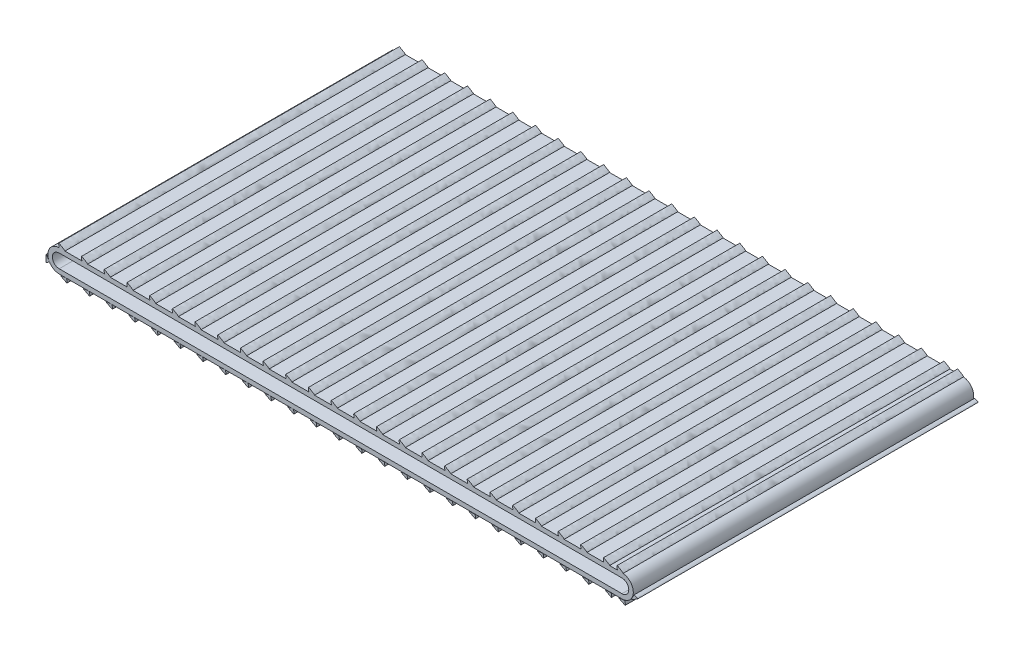
from build123d import *

# Parameters (mm, degrees)
BOSS_EXTRUDE1_DEPTH = 750
BOSS_EXTRUDE2_DEPTH = 750


with BuildPart() as part:
    # Sketch1 → Boss-Extrude1 (new body)
    with BuildSketch(Plane.XY):
        with BuildLine():
            Line((0, 0), (1240, 0))
            ThreePointArc((1240, 0), (1265, 25), (1240, 50))
            Line((1240, 50), (0, 50))
            ThreePointArc((0, 50), (-25, 25), (0, 0))
        make_face()
        with BuildLine():
            Line((0, 40), (1240, 40))
            ThreePointArc((1240, 40), (1255, 25), (1240, 10))
            Line((1240, 10), (0, 10))
            ThreePointArc((0, 10), (-15, 25), (0, 40))
        make_face(mode=Mode.SUBTRACT)
    extrude(amount=BOSS_EXTRUDE1_DEPTH)

    # Sketch3 → Boss-Extrude2 (add)
    with BuildSketch(Plane.XY):
        with BuildLine():
            Line((7.447139139, 50), (0, 50))
            add(Edge.make_bspline(
                [(0, 50), (-0.902771126, 54.485143955), (-2.069751857, 60.282933027), (5.151725689, 55.11021103), (14.289362764, 50.76827718), (12.567785976, 50)],
                knots=[0, 0, 0, 0, 0.295977916, 0.382600324, 0.822654792, 0.822654792, 0.822654792, 0.822654792], degree=3))
            Line((12.567785976, 50), (7.447139139, 50))
        make_face()
        with BuildLine():
            Line((57.447139139, 50), (62.567785976, 50))
            add(Edge.make_bspline(
                [(50, 50), (49.097228874, 54.485143955), (47.930248143, 60.282933027), (55.151725689, 55.11021103), (64.289362764, 50.76827718), (62.567785976, 50)],
                knots=[0, 0, 0, 0, 0.295977916, 0.382600324, 0.822654792, 0.822654792, 0.822654792, 0.822654792], degree=3))
            Line((50, 50), (57.447139139, 50))
        make_face()
        with BuildLine():
            Line((107.447139139, 50), (112.567785976, 50))
            add(Edge.make_bspline(
                [(100, 50), (99.097228874, 54.485143955), (97.930248143, 60.282933027), (105.151725689, 55.11021103), (114.289362764, 50.76827718), (112.567785976, 50)],
                knots=[0, 0, 0, 0, 0.295977916, 0.382600324, 0.822654792, 0.822654792, 0.822654792, 0.822654792], degree=3))
            Line((100, 50), (107.447139139, 50))
        make_face()
        with BuildLine():
            Line((157.447139139, 50), (162.567785976, 50))
            add(Edge.make_bspline(
                [(150, 50), (149.097228874, 54.485143955), (147.930248143, 60.282933027), (155.151725689, 55.11021103), (164.289362764, 50.76827718), (162.567785976, 50)],
                knots=[0, 0, 0, 0, 0.295977916, 0.382600324, 0.822654792, 0.822654792, 0.822654792, 0.822654792], degree=3))
            Line((150, 50), (157.447139139, 50))
        make_face()
        with BuildLine():
            Line((207.447139139, 50), (212.567785976, 50))
            add(Edge.make_bspline(
                [(200, 50), (199.097228874, 54.485143955), (197.930248143, 60.282933027), (205.151725689, 55.11021103), (214.289362764, 50.76827718), (212.567785976, 50)],
                knots=[0, 0, 0, 0, 0.295977916, 0.382600324, 0.822654792, 0.822654792, 0.822654792, 0.822654792], degree=3))
            Line((200, 50), (207.447139139, 50))
        make_face()
        with BuildLine():
            Line((257.447139139, 50), (262.567785976, 50))
            add(Edge.make_bspline(
                [(250, 50), (249.097228874, 54.485143955), (247.930248143, 60.282933027), (255.151725689, 55.11021103), (264.289362764, 50.76827718), (262.567785976, 50)],
                knots=[0, 0, 0, 0, 0.295977916, 0.382600324, 0.822654792, 0.822654792, 0.822654792, 0.822654792], degree=3))
            Line((250, 50), (257.447139139, 50))
        make_face()
        with BuildLine():
            Line((307.447139139, 50), (312.567785976, 50))
            add(Edge.make_bspline(
                [(300, 50), (299.097228874, 54.485143955), (297.930248143, 60.282933027), (305.151725689, 55.11021103), (314.289362764, 50.76827718), (312.567785976, 50)],
                knots=[0, 0, 0, 0, 0.295977916, 0.382600324, 0.822654792, 0.822654792, 0.822654792, 0.822654792], degree=3))
            Line((300, 50), (307.447139139, 50))
        make_face()
        with BuildLine():
            Line((357.447139139, 50), (362.567785976, 50))
            add(Edge.make_bspline(
                [(350, 50), (349.097228874, 54.485143955), (347.930248143, 60.282933027), (355.151725689, 55.11021103), (364.289362764, 50.76827718), (362.567785976, 50)],
                knots=[0, 0, 0, 0, 0.295977916, 0.382600324, 0.822654792, 0.822654792, 0.822654792, 0.822654792], degree=3))
            Line((350, 50), (357.447139139, 50))
        make_face()
        with BuildLine():
            Line((407.447139139, 50), (412.567785976, 50))
            add(Edge.make_bspline(
                [(400, 50), (399.097228874, 54.485143955), (397.930248143, 60.282933027), (405.151725689, 55.11021103), (414.289362764, 50.76827718), (412.567785976, 50)],
                knots=[0, 0, 0, 0, 0.295977916, 0.382600324, 0.822654792, 0.822654792, 0.822654792, 0.822654792], degree=3))
            Line((400, 50), (407.447139139, 50))
        make_face()
        with BuildLine():
            Line((457.447139139, 50), (462.567785976, 50))
            add(Edge.make_bspline(
                [(450, 50), (449.097228874, 54.485143955), (447.930248143, 60.282933027), (455.151725689, 55.11021103), (464.289362764, 50.76827718), (462.567785976, 50)],
                knots=[0, 0, 0, 0, 0.295977916, 0.382600324, 0.822654792, 0.822654792, 0.822654792, 0.822654792], degree=3))
            Line((450, 50), (457.447139139, 50))
        make_face()
        with BuildLine():
            Line((507.447139139, 50), (512.567785976, 50))
            add(Edge.make_bspline(
                [(500, 50), (499.097228874, 54.485143955), (497.930248143, 60.282933027), (505.151725689, 55.11021103), (514.289362764, 50.76827718), (512.567785976, 50)],
                knots=[0, 0, 0, 0, 0.295977916, 0.382600324, 0.822654792, 0.822654792, 0.822654792, 0.822654792], degree=3))
            Line((500, 50), (507.447139139, 50))
        make_face()
        with BuildLine():
            Line((557.447139139, 50), (562.567785976, 50))
            add(Edge.make_bspline(
                [(550, 50), (549.097228874, 54.485143955), (547.930248143, 60.282933027), (555.151725689, 55.11021103), (564.289362764, 50.76827718), (562.567785976, 50)],
                knots=[0, 0, 0, 0, 0.295977916, 0.382600324, 0.822654792, 0.822654792, 0.822654792, 0.822654792], degree=3))
            Line((550, 50), (557.447139139, 50))
        make_face()
        with BuildLine():
            Line((607.447139139, 50), (612.567785976, 50))
            add(Edge.make_bspline(
                [(600, 50), (599.097228874, 54.485143955), (597.930248143, 60.282933027), (605.151725689, 55.11021103), (614.289362764, 50.76827718), (612.567785976, 50)],
                knots=[0, 0, 0, 0, 0.295977916, 0.382600324, 0.822654792, 0.822654792, 0.822654792, 0.822654792], degree=3))
            Line((600, 50), (607.447139139, 50))
        make_face()
        with BuildLine():
            Line((657.447139139, 50), (662.567785976, 50))
            add(Edge.make_bspline(
                [(650, 50), (649.097228874, 54.485143955), (647.930248143, 60.282933027), (655.151725689, 55.11021103), (664.289362764, 50.76827718), (662.567785976, 50)],
                knots=[0, 0, 0, 0, 0.295977916, 0.382600324, 0.822654792, 0.822654792, 0.822654792, 0.822654792], degree=3))
            Line((650, 50), (657.447139139, 50))
        make_face()
        with BuildLine():
            Line((707.447139139, 50), (712.567785976, 50))
            add(Edge.make_bspline(
                [(700, 50), (699.097228874, 54.485143955), (697.930248143, 60.282933027), (705.151725689, 55.11021103), (714.289362764, 50.76827718), (712.567785976, 50)],
                knots=[0, 0, 0, 0, 0.295977916, 0.382600324, 0.822654792, 0.822654792, 0.822654792, 0.822654792], degree=3))
            Line((700, 50), (707.447139139, 50))
        make_face()
        with BuildLine():
            Line((757.447139139, 50), (762.567785976, 50))
            add(Edge.make_bspline(
                [(750, 50), (749.097228874, 54.485143955), (747.930248143, 60.282933027), (755.151725689, 55.11021103), (764.289362764, 50.76827718), (762.567785976, 50)],
                knots=[0, 0, 0, 0, 0.295977916, 0.382600324, 0.822654792, 0.822654792, 0.822654792, 0.822654792], degree=3))
            Line((750, 50), (757.447139139, 50))
        make_face()
        with BuildLine():
            Line((807.447139139, 50), (812.567785976, 50))
            add(Edge.make_bspline(
                [(800, 50), (799.097228874, 54.485143955), (797.930248143, 60.282933027), (805.151725689, 55.11021103), (814.289362764, 50.76827718), (812.567785976, 50)],
                knots=[0, 0, 0, 0, 0.295977916, 0.382600324, 0.822654792, 0.822654792, 0.822654792, 0.822654792], degree=3))
            Line((800, 50), (807.447139139, 50))
        make_face()
        with BuildLine():
            Line((857.447139139, 50), (862.567785976, 50))
            add(Edge.make_bspline(
                [(850, 50), (849.097228874, 54.485143955), (847.930248143, 60.282933027), (855.151725689, 55.11021103), (864.289362764, 50.76827718), (862.567785976, 50)],
                knots=[0, 0, 0, 0, 0.295977916, 0.382600324, 0.822654792, 0.822654792, 0.822654792, 0.822654792], degree=3))
            Line((850, 50), (857.447139139, 50))
        make_face()
        with BuildLine():
            Line((907.447139139, 50), (912.567785976, 50))
            add(Edge.make_bspline(
                [(900, 50), (899.097228874, 54.485143955), (897.930248143, 60.282933027), (905.151725689, 55.11021103), (914.289362764, 50.76827718), (912.567785976, 50)],
                knots=[0, 0, 0, 0, 0.295977916, 0.382600324, 0.822654792, 0.822654792, 0.822654792, 0.822654792], degree=3))
            Line((900, 50), (907.447139139, 50))
        make_face()
        with BuildLine():
            Line((957.447139139, 50), (962.567785976, 50))
            add(Edge.make_bspline(
                [(950, 50), (949.097228874, 54.485143955), (947.930248143, 60.282933027), (955.151725689, 55.11021103), (964.289362764, 50.76827718), (962.567785976, 50)],
                knots=[0, 0, 0, 0, 0.295977916, 0.382600324, 0.822654792, 0.822654792, 0.822654792, 0.822654792], degree=3))
            Line((950, 50), (957.447139139, 50))
        make_face()
        with BuildLine():
            Line((1007.447139139, 50), (1012.567785976, 50))
            add(Edge.make_bspline(
                [(1000, 50), (999.097228874, 54.485143955), (997.930248143, 60.282933027), (1005.151725689, 55.11021103), (1014.289362764, 50.76827718), (1012.567785976, 50)],
                knots=[0, 0, 0, 0, 0.295977916, 0.382600324, 0.822654792, 0.822654792, 0.822654792, 0.822654792], degree=3))
            Line((1000, 50), (1007.447139139, 50))
        make_face()
        with BuildLine():
            Line((1057.447139139, 50), (1062.567785976, 50))
            add(Edge.make_bspline(
                [(1050, 50), (1049.097228874, 54.485143955), (1047.930248143, 60.282933027), (1055.151725689, 55.11021103), (1064.289362764, 50.76827718), (1062.567785976, 50)],
                knots=[0, 0, 0, 0, 0.295977916, 0.382600324, 0.822654792, 0.822654792, 0.822654792, 0.822654792], degree=3))
            Line((1050, 50), (1057.447139139, 50))
        make_face()
        with BuildLine():
            Line((1107.447139139, 50), (1112.567785976, 50))
            add(Edge.make_bspline(
                [(1100, 50), (1099.097228874, 54.485143955), (1097.930248143, 60.282933027), (1105.151725689, 55.11021103), (1114.289362764, 50.76827718), (1112.567785976, 50)],
                knots=[0, 0, 0, 0, 0.295977916, 0.382600324, 0.822654792, 0.822654792, 0.822654792, 0.822654792], degree=3))
            Line((1100, 50), (1107.447139139, 50))
        make_face()
        with BuildLine():
            Line((1157.447139139, 50), (1162.567785976, 50))
            add(Edge.make_bspline(
                [(1150, 50), (1149.097228874, 54.485143955), (1147.930248143, 60.282933027), (1155.151725689, 55.11021103), (1164.289362764, 50.76827718), (1162.567785976, 50)],
                knots=[0, 0, 0, 0, 0.295977916, 0.382600324, 0.822654792, 0.822654792, 0.822654792, 0.822654792], degree=3))
            Line((1150, 50), (1157.447139139, 50))
        make_face()
        with BuildLine():
            Line((1207.447139139, 50), (1212.567785976, 50))
            add(Edge.make_bspline(
                [(1200, 50), (1199.097228874, 54.485143955), (1197.930248143, 60.282933027), (1205.151725689, 55.11021103), (1214.289362764, 50.76827718), (1212.567785976, 50)],
                knots=[0, 0, 0, 0, 0.295977916, 0.382600324, 0.822654792, 0.822654792, 0.822654792, 0.822654792], degree=3))
            Line((1200, 50), (1207.447139139, 50))
        make_face()
        with BuildLine():
            Line((-25.374204664, 18.94941168), (-27.934528082, 23.384021924))
            add(Edge.make_bspline(
                [(-21.650635095, 12.5), (-25.083498136, 9.475605293), (-29.521040393, 5.566075798), (-28.65207051, 14.406419805), (-29.460664032, 24.490812567), (-27.934528082, 23.384021924)],
                knots=[0, 0, 0, 0, 0.295977916, 0.382600324, 0.822654792, 0.822654792, 0.822654792, 0.822654792], degree=3))
            Line((-21.650635095, 12.5), (-25.374204664, 18.94941168))
        make_face()
        with BuildLine():
            Line((1263.097135437, 14.710842358), (1260.536812019, 10.276232114))
            add(Edge.make_bspline(
                [(1266.820705007, 21.160254038), (1271.156339175, 19.69950479), (1276.760862162, 17.811245212), (1268.670414733, 14.143623202), (1260.34137118, 8.40116429), (1260.536812019, 10.276232114)],
                knots=[0, 0, 0, 0, 0.295977916, 0.382600324, 0.822654792, 0.822654792, 0.822654792, 0.822654792], degree=3))
            Line((1266.820705007, 21.160254038), (1263.097135437, 14.710842358))
        make_face()
        with BuildLine():
            Line((1237.447139139, 50), (1242.567785976, 50))
            add(Edge.make_bspline(
                [(1230, 50), (1229.097228874, 54.485143955), (1227.930248143, 60.282933027), (1235.151725689, 55.11021103), (1244.289362764, 50.76827718), (1242.567785976, 50)],
                knots=[0, 0, 0, 0, 0.295977916, 0.382600324, 0.822654792, 0.822654792, 0.822654792, 0.822654792], degree=3))
            Line((1230, 50), (1237.447139139, 50))
        make_face()
        with BuildLine():
            Line((1208.662700043, -0.628162304), (1203.549650432, -0.906995064))
            add(Edge.make_bspline(
                [(1216.098790265, -0.222645887), (1217.244449946, -4.651977202), (1218.725404236, -10.377619222), (1211.232972414, -5.605800259), (1201.872462578, -1.767876801), (1203.549650432, -0.906995064)],
                knots=[0, 0, 0, 0, 0.295977916, 0.382600324, 0.822654792, 0.822654792, 0.822654792, 0.822654792], degree=3))
            Line((1216.098790265, -0.222645887), (1208.662700043, -0.628162304))
        make_face()
        with BuildLine():
            Line((1158.662700043, -0.628162304), (1153.549650432, -0.906995064))
            add(Edge.make_bspline(
                [(1166.098790265, -0.222645887), (1167.244449946, -4.651977202), (1168.725404236, -10.377619222), (1161.232972414, -5.605800259), (1151.872462578, -1.767876801), (1153.549650432, -0.906995064)],
                knots=[0, 0, 0, 0, 0.295977916, 0.382600324, 0.822654792, 0.822654792, 0.822654792, 0.822654792], degree=3))
            Line((1166.098790265, -0.222645887), (1158.662700043, -0.628162304))
        make_face()
        with BuildLine():
            Line((1108.662700043, -0.628162304), (1103.549650432, -0.906995064))
            add(Edge.make_bspline(
                [(1116.098790265, -0.222645887), (1117.244449946, -4.651977202), (1118.725404236, -10.377619222), (1111.232972414, -5.605800259), (1101.872462578, -1.767876801), (1103.549650432, -0.906995064)],
                knots=[0, 0, 0, 0, 0.295977916, 0.382600324, 0.822654792, 0.822654792, 0.822654792, 0.822654792], degree=3))
            Line((1116.098790265, -0.222645887), (1108.662700043, -0.628162304))
        make_face()
        with BuildLine():
            Line((1058.662700043, -0.628162304), (1053.549650432, -0.906995064))
            add(Edge.make_bspline(
                [(1066.098790265, -0.222645887), (1067.244449946, -4.651977202), (1068.725404236, -10.377619222), (1061.232972414, -5.605800259), (1051.872462578, -1.767876801), (1053.549650432, -0.906995064)],
                knots=[0, 0, 0, 0, 0.295977916, 0.382600324, 0.822654792, 0.822654792, 0.822654792, 0.822654792], degree=3))
            Line((1066.098790265, -0.222645887), (1058.662700043, -0.628162304))
        make_face()
        with BuildLine():
            Line((1008.662700043, -0.628162304), (1003.549650432, -0.906995064))
            add(Edge.make_bspline(
                [(1016.098790265, -0.222645887), (1017.244449946, -4.651977202), (1018.725404236, -10.377619222), (1011.232972414, -5.605800259), (1001.872462578, -1.767876801), (1003.549650432, -0.906995064)],
                knots=[0, 0, 0, 0, 0.295977916, 0.382600324, 0.822654792, 0.822654792, 0.822654792, 0.822654792], degree=3))
            Line((1016.098790265, -0.222645887), (1008.662700043, -0.628162304))
        make_face()
        with BuildLine():
            Line((958.662700043, -0.628162304), (953.549650432, -0.906995064))
            add(Edge.make_bspline(
                [(966.098790265, -0.222645887), (967.244449946, -4.651977202), (968.725404236, -10.377619222), (961.232972414, -5.605800259), (951.872462578, -1.767876801), (953.549650432, -0.906995064)],
                knots=[0, 0, 0, 0, 0.295977916, 0.382600324, 0.822654792, 0.822654792, 0.822654792, 0.822654792], degree=3))
            Line((966.098790265, -0.222645887), (958.662700043, -0.628162304))
        make_face()
        with BuildLine():
            Line((908.662700043, -0.628162304), (903.549650432, -0.906995064))
            add(Edge.make_bspline(
                [(916.098790265, -0.222645887), (917.244449946, -4.651977202), (918.725404236, -10.377619222), (911.232972414, -5.605800259), (901.872462578, -1.767876801), (903.549650432, -0.906995064)],
                knots=[0, 0, 0, 0, 0.295977916, 0.382600324, 0.822654792, 0.822654792, 0.822654792, 0.822654792], degree=3))
            Line((916.098790265, -0.222645887), (908.662700043, -0.628162304))
        make_face()
        with BuildLine():
            Line((858.662700043, -0.628162304), (853.549650432, -0.906995064))
            add(Edge.make_bspline(
                [(866.098790265, -0.222645887), (867.244449946, -4.651977202), (868.725404236, -10.377619222), (861.232972414, -5.605800259), (851.872462578, -1.767876801), (853.549650432, -0.906995064)],
                knots=[0, 0, 0, 0, 0.295977916, 0.382600324, 0.822654792, 0.822654792, 0.822654792, 0.822654792], degree=3))
            Line((866.098790265, -0.222645887), (858.662700043, -0.628162304))
        make_face()
        with BuildLine():
            Line((808.662700043, -0.628162304), (803.549650432, -0.906995064))
            add(Edge.make_bspline(
                [(816.098790265, -0.222645887), (817.244449946, -4.651977202), (818.725404236, -10.377619222), (811.232972414, -5.605800259), (801.872462578, -1.767876801), (803.549650432, -0.906995064)],
                knots=[0, 0, 0, 0, 0.295977916, 0.382600324, 0.822654792, 0.822654792, 0.822654792, 0.822654792], degree=3))
            Line((816.098790265, -0.222645887), (808.662700043, -0.628162304))
        make_face()
        with BuildLine():
            Line((758.662700043, -0.628162304), (753.549650432, -0.906995064))
            add(Edge.make_bspline(
                [(766.098790265, -0.222645887), (767.244449946, -4.651977202), (768.725404236, -10.377619222), (761.232972414, -5.605800259), (751.872462578, -1.767876801), (753.549650432, -0.906995064)],
                knots=[0, 0, 0, 0, 0.295977916, 0.382600324, 0.822654792, 0.822654792, 0.822654792, 0.822654792], degree=3))
            Line((766.098790265, -0.222645887), (758.662700043, -0.628162304))
        make_face()
        with BuildLine():
            Line((708.662700043, -0.628162304), (703.549650432, -0.906995064))
            add(Edge.make_bspline(
                [(716.098790265, -0.222645887), (717.244449946, -4.651977202), (718.725404236, -10.377619222), (711.232972414, -5.605800259), (701.872462578, -1.767876801), (703.549650432, -0.906995064)],
                knots=[0, 0, 0, 0, 0.295977916, 0.382600324, 0.822654792, 0.822654792, 0.822654792, 0.822654792], degree=3))
            Line((716.098790265, -0.222645887), (708.662700043, -0.628162304))
        make_face()
        with BuildLine():
            Line((658.662700043, -0.628162304), (653.549650432, -0.906995064))
            add(Edge.make_bspline(
                [(666.098790265, -0.222645887), (667.244449946, -4.651977202), (668.725404236, -10.377619222), (661.232972414, -5.605800259), (651.872462578, -1.767876801), (653.549650432, -0.906995064)],
                knots=[0, 0, 0, 0, 0.295977916, 0.382600324, 0.822654792, 0.822654792, 0.822654792, 0.822654792], degree=3))
            Line((666.098790265, -0.222645887), (658.662700043, -0.628162304))
        make_face()
        with BuildLine():
            Line((608.662700043, -0.628162304), (603.549650432, -0.906995064))
            add(Edge.make_bspline(
                [(616.098790265, -0.222645887), (617.244449946, -4.651977202), (618.725404236, -10.377619222), (611.232972414, -5.605800259), (601.872462578, -1.767876801), (603.549650432, -0.906995064)],
                knots=[0, 0, 0, 0, 0.295977916, 0.382600324, 0.822654792, 0.822654792, 0.822654792, 0.822654792], degree=3))
            Line((616.098790265, -0.222645887), (608.662700043, -0.628162304))
        make_face()
        with BuildLine():
            Line((558.662700043, -0.628162304), (553.549650432, -0.906995064))
            add(Edge.make_bspline(
                [(566.098790265, -0.222645887), (567.244449946, -4.651977202), (568.725404236, -10.377619222), (561.232972414, -5.605800259), (551.872462578, -1.767876801), (553.549650432, -0.906995064)],
                knots=[0, 0, 0, 0, 0.295977916, 0.382600324, 0.822654792, 0.822654792, 0.822654792, 0.822654792], degree=3))
            Line((566.098790265, -0.222645887), (558.662700043, -0.628162304))
        make_face()
        with BuildLine():
            Line((508.662700043, -0.628162304), (503.549650432, -0.906995064))
            add(Edge.make_bspline(
                [(516.098790265, -0.222645887), (517.244449946, -4.651977202), (518.725404236, -10.377619222), (511.232972414, -5.605800259), (501.872462578, -1.767876801), (503.549650432, -0.906995064)],
                knots=[0, 0, 0, 0, 0.295977916, 0.382600324, 0.822654792, 0.822654792, 0.822654792, 0.822654792], degree=3))
            Line((516.098790265, -0.222645887), (508.662700043, -0.628162304))
        make_face()
        with BuildLine():
            Line((458.662700043, -0.628162304), (453.549650432, -0.906995064))
            add(Edge.make_bspline(
                [(466.098790265, -0.222645887), (467.244449946, -4.651977202), (468.725404236, -10.377619222), (461.232972414, -5.605800259), (451.872462578, -1.767876801), (453.549650432, -0.906995064)],
                knots=[0, 0, 0, 0, 0.295977916, 0.382600324, 0.822654792, 0.822654792, 0.822654792, 0.822654792], degree=3))
            Line((466.098790265, -0.222645887), (458.662700043, -0.628162304))
        make_face()
        with BuildLine():
            Line((408.662700043, -0.628162304), (403.549650432, -0.906995064))
            add(Edge.make_bspline(
                [(416.098790265, -0.222645887), (417.244449946, -4.651977202), (418.725404236, -10.377619222), (411.232972414, -5.605800259), (401.872462578, -1.767876801), (403.549650432, -0.906995064)],
                knots=[0, 0, 0, 0, 0.295977916, 0.382600324, 0.822654792, 0.822654792, 0.822654792, 0.822654792], degree=3))
            Line((416.098790265, -0.222645887), (408.662700043, -0.628162304))
        make_face()
        with BuildLine():
            Line((358.662700043, -0.628162304), (353.549650432, -0.906995064))
            add(Edge.make_bspline(
                [(366.098790265, -0.222645887), (367.244449946, -4.651977202), (368.725404236, -10.377619222), (361.232972414, -5.605800259), (351.872462578, -1.767876801), (353.549650432, -0.906995064)],
                knots=[0, 0, 0, 0, 0.295977916, 0.382600324, 0.822654792, 0.822654792, 0.822654792, 0.822654792], degree=3))
            Line((366.098790265, -0.222645887), (358.662700043, -0.628162304))
        make_face()
        with BuildLine():
            Line((308.662700043, -0.628162304), (303.549650432, -0.906995064))
            add(Edge.make_bspline(
                [(316.098790265, -0.222645887), (317.244449946, -4.651977202), (318.725404236, -10.377619222), (311.232972414, -5.605800259), (301.872462578, -1.767876801), (303.549650432, -0.906995064)],
                knots=[0, 0, 0, 0, 0.295977916, 0.382600324, 0.822654792, 0.822654792, 0.822654792, 0.822654792], degree=3))
            Line((316.098790265, -0.222645887), (308.662700043, -0.628162304))
        make_face()
        with BuildLine():
            Line((258.662700043, -0.628162304), (253.549650432, -0.906995064))
            add(Edge.make_bspline(
                [(266.098790265, -0.222645887), (267.244449946, -4.651977202), (268.725404236, -10.377619222), (261.232972414, -5.605800259), (251.872462578, -1.767876801), (253.549650432, -0.906995064)],
                knots=[0, 0, 0, 0, 0.295977916, 0.382600324, 0.822654792, 0.822654792, 0.822654792, 0.822654792], degree=3))
            Line((266.098790265, -0.222645887), (258.662700043, -0.628162304))
        make_face()
        with BuildLine():
            Line((208.662700043, -0.628162304), (203.549650432, -0.906995064))
            add(Edge.make_bspline(
                [(216.098790265, -0.222645887), (217.244449946, -4.651977202), (218.725404236, -10.377619222), (211.232972414, -5.605800259), (201.872462578, -1.767876801), (203.549650432, -0.906995064)],
                knots=[0, 0, 0, 0, 0.295977916, 0.382600324, 0.822654792, 0.822654792, 0.822654792, 0.822654792], degree=3))
            Line((216.098790265, -0.222645887), (208.662700043, -0.628162304))
        make_face()
        with BuildLine():
            Line((158.662700043, -0.628162304), (153.549650432, -0.906995064))
            add(Edge.make_bspline(
                [(166.098790265, -0.222645887), (167.244449946, -4.651977202), (168.725404236, -10.377619222), (161.232972414, -5.605800259), (151.872462578, -1.767876801), (153.549650432, -0.906995064)],
                knots=[0, 0, 0, 0, 0.295977916, 0.382600324, 0.822654792, 0.822654792, 0.822654792, 0.822654792], degree=3))
            Line((166.098790265, -0.222645887), (158.662700043, -0.628162304))
        make_face()
        with BuildLine():
            Line((108.662700043, -0.628162304), (103.549650432, -0.906995064))
            add(Edge.make_bspline(
                [(116.098790265, -0.222645887), (117.244449946, -4.651977202), (118.725404236, -10.377619222), (111.232972414, -5.605800259), (101.872462578, -1.767876801), (103.549650432, -0.906995064)],
                knots=[0, 0, 0, 0, 0.295977916, 0.382600324, 0.822654792, 0.822654792, 0.822654792, 0.822654792], degree=3))
            Line((116.098790265, -0.222645887), (108.662700043, -0.628162304))
        make_face()
        with BuildLine():
            Line((58.662700043, -0.628162304), (53.549650432, -0.906995064))
            add(Edge.make_bspline(
                [(66.098790265, -0.222645887), (67.244449946, -4.651977202), (68.725404236, -10.377619222), (61.232972414, -5.605800259), (51.872462578, -1.767876801), (53.549650432, -0.906995064)],
                knots=[0, 0, 0, 0, 0.295977916, 0.382600324, 0.822654792, 0.822654792, 0.822654792, 0.822654792], degree=3))
            Line((66.098790265, -0.222645887), (58.662700043, -0.628162304))
        make_face()
        with BuildLine():
            Line((8.662700043, -0.628162304), (3.549650432, -0.906995064))
            add(Edge.make_bspline(
                [(16.098790265, -0.222645887), (17.244449946, -4.651977202), (18.725404236, -10.377619222), (11.232972414, -5.605800259), (1.872462578, -1.767876801), (3.549650432, -0.906995064)],
                knots=[0, 0, 0, 0, 0.295977916, 0.382600324, 0.822654792, 0.822654792, 0.822654792, 0.822654792], degree=3))
            Line((16.098790265, -0.222645887), (8.662700043, -0.628162304))
        make_face()
        with BuildLine():
            Line((1238.662700043, -0.628162304), (1233.549650432, -0.906995064))
            add(Edge.make_bspline(
                [(1246.098790265, -0.222645887), (1247.244449946, -4.651977202), (1248.725404236, -10.377619222), (1241.232972414, -5.605800259), (1231.872462578, -1.767876801), (1233.549650432, -0.906995064)],
                knots=[0, 0, 0, 0, 0.295977916, 0.382600324, 0.822654792, 0.822654792, 0.822654792, 0.822654792], degree=3))
            Line((1246.098790265, -0.222645887), (1238.662700043, -0.628162304))
        make_face()
    extrude(amount=BOSS_EXTRUDE2_DEPTH)


solid = part.part
